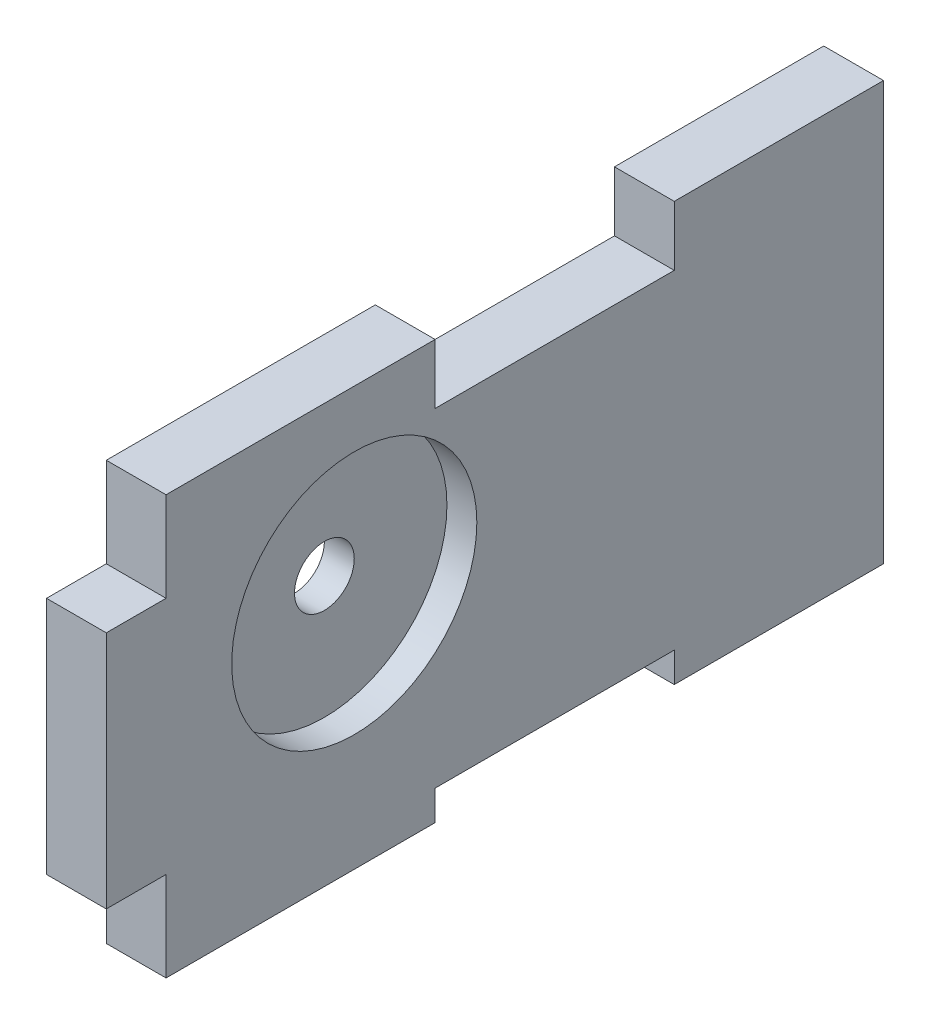
from build123d import *

# Parameters (mm, degrees)
BOSS_EXTRUDE1_DEPTH = 10
SKETCH2_R           = 20.5
CUT_EXTRUDE1_DEPTH  = 5
SKETCH4_R           = 5
CUT_EXTRUDE3_DEPTH  = 148.732867027
SKETCH5_R           = 5
CUT_EXTRUDE4_DEPTH  = 5
SKETCH6_W           = 10
SKETCH6_H           = 40
CUT_EXTRUDE5_DEPTH  = 5


with BuildPart() as part:
    # Sketch1 → Boss-Extrude1 (new body)
    with BuildSketch(Plane(origin=(0, 0, 0), x_dir=(0, 0, -1), z_dir=(1, 0, 0))):
        Polygon((-75, 70), (-120, 70), (-120, 55), (-130, 55), (-130, 15), (-120, 15), (-120, 0), (-75, 0), (-75, 5), (-35, 5), (-35, 0), (-10, 0), (0, 0), (0, 15), (0, 55), (0, 70), (-10, 70), (-35, 70), (-35, 60), (-75, 60), align=None)
    extrude(amount=BOSS_EXTRUDE1_DEPTH)

    # Sketch2 → Cut-Extrude1 (cut)
    with BuildSketch(Plane(origin=(10, 0, 0), x_dir=(0, 0, -1), z_dir=(1, 0, 0))):
        with Locations((-88.52, 40)):
            Circle(SKETCH2_R)
    extrude(amount=-CUT_EXTRUDE1_DEPTH, mode=Mode.SUBTRACT)

    # Sketch4 → Cut-Extrude3 (cut, through all)
    with BuildSketch(Plane(origin=(5, 0, 0), x_dir=(0, 0, -1), z_dir=(1, 0, 0))):
        with Locations((-88.52, 40)):
            Circle(SKETCH4_R)
    extrude(amount=-CUT_EXTRUDE3_DEPTH, mode=Mode.SUBTRACT)

    # Sketch5 → Cut-Extrude4 (cut)
    with BuildSketch(Plane.ZY):
        with Locations((17.11, 26.509090973)):
            Circle(SKETCH5_R)
        with Locations((52.52, 33)):
            Circle(SKETCH5_R)
    extrude(amount=-CUT_EXTRUDE4_DEPTH, mode=Mode.SUBTRACT)

    # Sketch6 → Cut-Extrude5 (cut)
    with BuildSketch(Plane.ZY):
        with Locations((5, 35)):
            Rectangle(SKETCH6_W, SKETCH6_H)
    extrude(amount=-CUT_EXTRUDE5_DEPTH, mode=Mode.SUBTRACT)


solid = part.part
